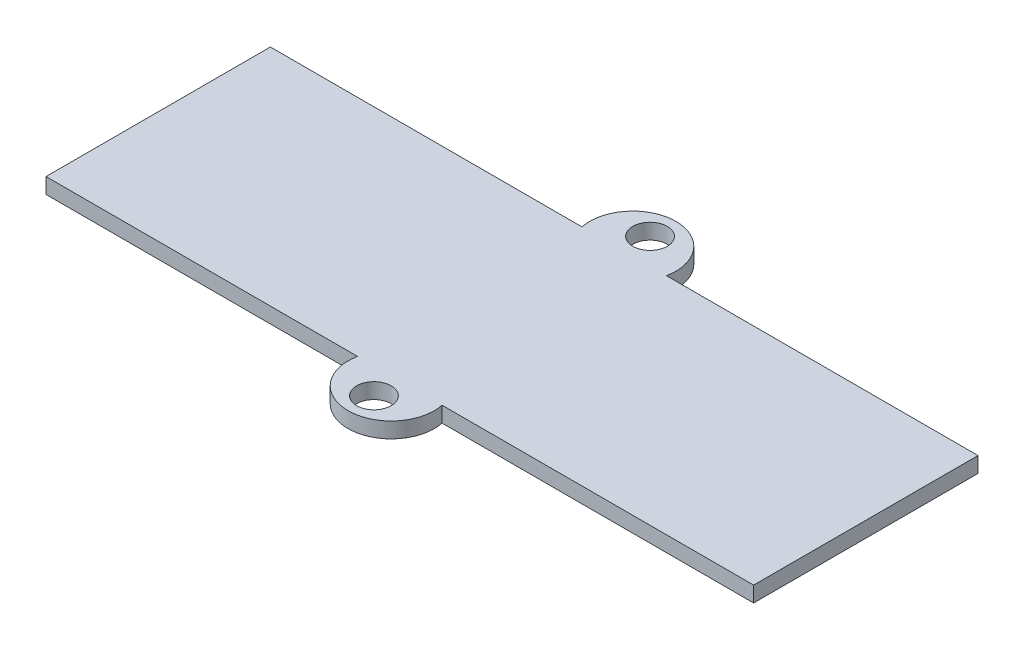
from build123d import *

# Parameters (mm, degrees)
SKETCH1_R           = 2
BOSS_EXTRUDE1_DEPTH = 1.8


with BuildPart() as part:
    # Sketch1 → Boss-Extrude1 (new body)
    with BuildSketch(Plane(origin=(0, 0, 0), x_dir=(1, 0, 0), z_dir=(0, 1, 0))):
        with BuildLine():
            Line((118.18380357, 2.009694076), (82.082783055, 2.009694076))
            Line((82.082783055, 2.009694076), (82.082783055, -23.990305924))
            Line((82.082783055, -23.990305924), (118.18380357, -23.990305924))
            ThreePointArc((118.18380357, -23.990305924), (123.082783055, -29.990305924), (127.981762541, -23.990305924))
            Line((127.981762541, -23.990305924), (164.082783055, -23.990305924))
            Line((164.082783055, -23.990305924), (164.082783055, 2.009694076))
            Line((164.082783055, 2.009694076), (127.981762541, 2.009694076))
            ThreePointArc((127.981762541, 2.009694076), (123.082783055, 8.009694076), (118.18380357, 2.009694076))
        make_face()
        with Locations(Location((123.082783055, 5.009694076, 0), (0, 0, 270))):
            Circle(SKETCH1_R, mode=Mode.SUBTRACT)
        with Locations(Location((123.082783055, -26.990305924, 0), (0, 0, 270))):
            Circle(SKETCH1_R, mode=Mode.SUBTRACT)
    extrude(amount=BOSS_EXTRUDE1_DEPTH)


solid = part.part
